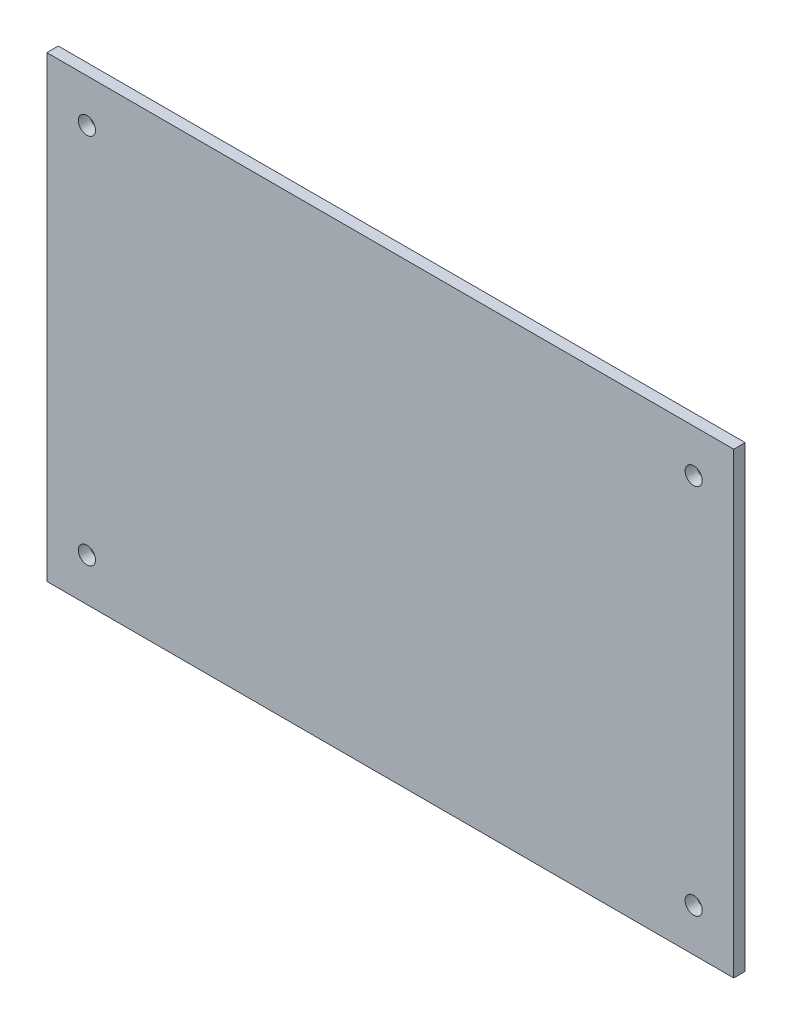
from build123d import *

# Parameters (mm, degrees)
ESQUISSE1_W        = 120
ESQUISSE1_H        = 80
ESQUISSE1_R        = 1.5
BOSS_EXTRU_1_DEPTH = 2


with BuildPart() as part:
    # Esquisse1 → Boss.-Extru.1 (new body)
    with BuildSketch(Plane.XY):
        Rectangle(ESQUISSE1_W, ESQUISSE1_H)
        with Locations((-53, 32.5)):
            Circle(ESQUISSE1_R, mode=Mode.SUBTRACT)
        with Locations((53, 32.5)):
            Circle(ESQUISSE1_R, mode=Mode.SUBTRACT)
        with Locations((53, -32.5)):
            Circle(ESQUISSE1_R, mode=Mode.SUBTRACT)
        with Locations((-53, -32.5)):
            Circle(ESQUISSE1_R, mode=Mode.SUBTRACT)
    extrude(amount=BOSS_EXTRU_1_DEPTH)


solid = part.part
